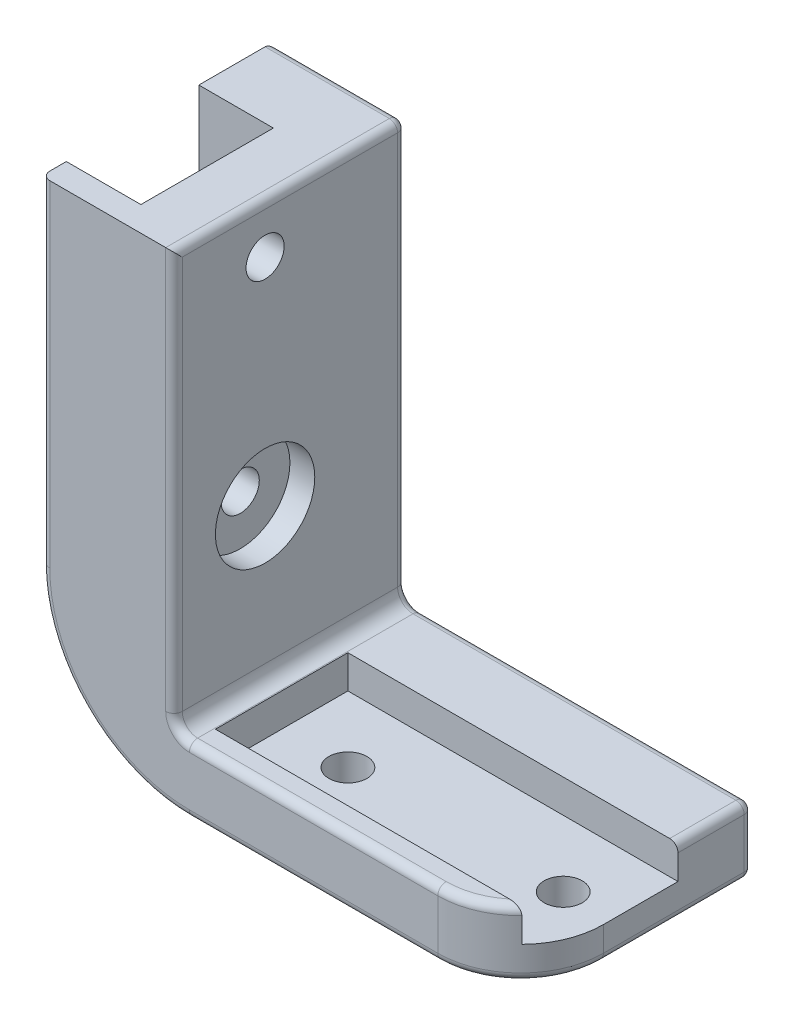
from build123d import *

# Parameters (mm, degrees)
BOSS_EXTRUDE2_DEPTH     = 14
CUT_EXTRUDE1_DEPTH      = 6
CUT_EXTRUDE1_DEPTH_BACK = 35.266447159
SKETCH3_R               = 1.15
SKETCH4_R               = 1.15
CUT_EXTRUDE2_DEPTH      = 35.655532064
CUT_EXTRUDE3_DEPTH      = 35.655532064
SKETCH6_W               = 22
SKETCH6_H               = 8
CUT_EXTRUDE4_DEPTH      = 2
SKETCH7_W               = 8
SKETCH7_H               = 21
CUT_EXTRUDE5_DEPTH      = 4.5
FILLET3_R               = 0.5
SKETCH8_R               = 3
CUT_EXTRUDE7_DEPTH      = 1.5


with BuildPart() as part:
    # Sketch2 → Boss-Extrude2 (new body)
    with BuildSketch(Plane.XY):
        with BuildLine():
            Line((-0.744994158, -5.943357372), (19.255005842, -5.943357372))
            Line((19.255005842, -5.943357372), (19.255005842, -1.943357372))
            Line((19.255005842, -1.943357372), (-0.744994158, -1.943357372))
            ThreePointArc((-0.744994158, -1.943357372), (-1.402291473, -1.67109591), (-1.674552936, -1.013798594))
            Line((-1.674552936, -1.013798594), (-1.674552936, 23.240976104))
            Line((-1.674552936, 23.240976104), (-9.674552936, 23.240976104))
            Line((-9.674552936, 23.240976104), (-9.674552936, 2.986201406))
            ThreePointArc((-9.674552936, 2.986201406), (-7.059145723, -3.327950159), (-0.744994158, -5.943357372))
        make_face()
    extrude(amount=BOSS_EXTRUDE2_DEPTH)

    # Sketch3 → Cut-Extrude1 (cut, two sides: drawn at the far end of the back side and taken through both)
    with BuildSketch(Plane(origin=(-1.674552936, 0, 0), x_dir=(0, 0, -1), z_dir=(1, 0, 0)).offset(-CUT_EXTRUDE1_DEPTH_BACK)):
        with Locations(Location((-8.5, 20.240976104, 0), (0, 0, 180))):
            Circle(SKETCH3_R)
        with Locations(Location((-8.5, 7.240976104, 0), (0, 0, 180))):
            Circle(SKETCH3_R)
    extrude(amount=CUT_EXTRUDE1_DEPTH + CUT_EXTRUDE1_DEPTH_BACK, mode=Mode.SUBTRACT)

    # Sketch4 → Cut-Extrude2 (cut, through all)
    with BuildSketch(Plane(origin=(0, -1.943357372, 0), x_dir=(1, 0, 0), z_dir=(0, 1, 0))):
        with Locations(Location((3.325447064, -8.5, 0), (0, 0, 180))):
            Circle(SKETCH4_R)
        with Locations(Location((16.325447064, -8.5, 0), (0, 0, 180))):
            Circle(SKETCH4_R)
    extrude(amount=-CUT_EXTRUDE2_DEPTH, mode=Mode.SUBTRACT)

    # Sketch5 → Cut-Extrude3 (cut, through all)
    with BuildSketch(Plane(origin=(0, -1.943357372, 0), x_dir=(1, 0, 0), z_dir=(0, 1, 0))):
        with BuildLine():
            Line((19.255005842, -14), (14.255005842, -14))
            ThreePointArc((14.255005842, -14), (17.790539748, -12.535533906), (19.255005842, -9))
            Line((19.255005842, -9), (19.255005842, -14))
        make_face()
    extrude(amount=-CUT_EXTRUDE3_DEPTH, mode=Mode.SUBTRACT)

    # Sketch6 → Cut-Extrude4 (cut)
    with BuildSketch(Plane(origin=(0, -1.943357372, 0), x_dir=(1, 0, 0), z_dir=(0, 1, 0))):
        with Locations((10.325447064, -8.5)):
            Rectangle(SKETCH6_W, SKETCH6_H)
    extrude(amount=-CUT_EXTRUDE4_DEPTH, mode=Mode.SUBTRACT)

    # Sketch7 → Cut-Extrude5 (cut)
    with BuildSketch(Plane.ZY.offset(9.674552936)):
        with Locations((8.5, 14.133657814)):
            Rectangle(SKETCH7_W, SKETCH7_H)
    extrude(amount=-CUT_EXTRUDE5_DEPTH, mode=Mode.SUBTRACT)

    # Fillet3
    fillet3_edges = [part.edges().sort_by_distance(p)[0] for p in [
        (-1.402291473, -1.67109591, 14),
        (9.255005842, -1.943357372, 0),
        (19.255005842, -3.943357372, 0),
        (-1.674552936, 11.113588755, 14),
        (-1.674552936, 23.240976104, 7),
        (-9.674552936, 13.113588755, 14),
        (-7.059145723, -3.327950159, 14),
        (6.755005842, -5.943357372, 14),
        (6.755005842, -1.943357372, 14),
        (19.255005842, -5.943357372, 4.5),
        (17.790539748, -5.943357372, 12.535533906),
        (16.191497515, -1.943357372, 13.609772229),
        (19.255005842, -1.943357372, 2.25),
        (9.255005842, -5.943357372, 0),
        (-7.059145723, -3.327950159, 0),
        (-9.674552936, 13.113588755, 0),
        (-5.674552936, 23.240976104, 0),
        (-1.674552936, 11.113588755, 0),
        (-1.402291473, -1.67109591, 0),
    ]]
    fillet(fillet3_edges, radius=FILLET3_R)

    # Sketch8 → Cut-Extrude7 (cut)
    with BuildSketch(Plane(origin=(-1.674552936, 0, 0), x_dir=(0, 0, -1), z_dir=(1, 0, 0))):
        with Locations((-8.5, 7.240976104)):
            Circle(SKETCH8_R)
    extrude(amount=-CUT_EXTRUDE7_DEPTH, mode=Mode.SUBTRACT)


solid = part.part
